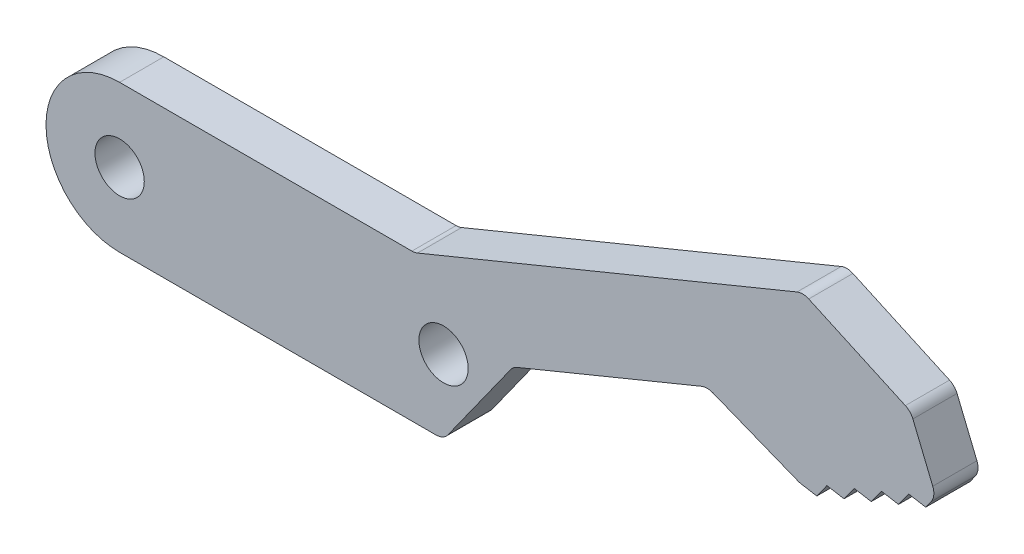
from build123d import *

# Parameters (mm, degrees)
SKETCH1_R           = 1.675
BOSS_EXTRUDE1_DEPTH = 3
FILLET1_R           = 1


with BuildPart() as part:
    # Sketch1 → Boss-Extrude1 (new body)
    with BuildSketch(Plane.XY):
        with BuildLine():
            Line((20.05, 5), (0, 5))
            ThreePointArc((0, 5), (-5, 0), (0, -5))
            Line((0, -5), (22, -5))
            Line((22, -5), (26.72989842, 1.621129525))
            Line((26.72989842, 1.621129525), (39.900164389, 7.036080522))
            Line((39.900164389, 7.036080522), (46.188488025, 4.540007042))
            Line((46.188488025, 4.540007042), (47.351030887, 4.342221563))
            Line((47.351030887, 4.342221563), (48.038244482, 5.300533868))
            Line((48.038244482, 5.300533868), (49.200787343, 5.102748388))
            Line((49.200787343, 5.102748388), (49.888000938, 6.061060693))
            Line((49.888000938, 6.061060693), (51.050543799, 5.863275214))
            Line((51.050543799, 5.863275214), (51.737757394, 6.821587519))
            Line((51.737757394, 6.821587519), (52.900300256, 6.623802039))
            Line((52.900300256, 6.623802039), (53.587513851, 7.582114344))
            Line((53.587513851, 7.582114344), (54.750056712, 7.384328864))
            Line((54.750056712, 7.384328864), (55.437270307, 8.34264117))
            Line((55.437270307, 8.34264117), (53.72608495, 12.504593197))
            Line((53.72608495, 12.504593197), (46.409029503, 15.837507263))
            Line((46.409029503, 15.837507263), (20.05, 5))
        make_face()
        Circle(SKETCH1_R, mode=Mode.SUBTRACT)
        with Locations((22, 0)):
            Circle(SKETCH1_R, mode=Mode.SUBTRACT)
    extrude(amount=BOSS_EXTRUDE1_DEPTH)

    # Fillet1
    fillet1_edges = [part.edges().sort_by_distance(p)[0] for p in [
        (22, -5, 1.5),
        (20.05, 5, 1.5),
        (46.409029503, 15.837507263, 1.5),
        (53.72608495, 12.504593197, 1.5),
        (55.437270307, 8.34264117, 1.5),
        (46.188488025, 4.540007042, 1.5),
        (39.900164389, 7.036080522, 1.5),
        (26.72989842, 1.621129525, 1.5),
    ]]
    fillet(fillet1_edges, radius=FILLET1_R)


solid = part.part
